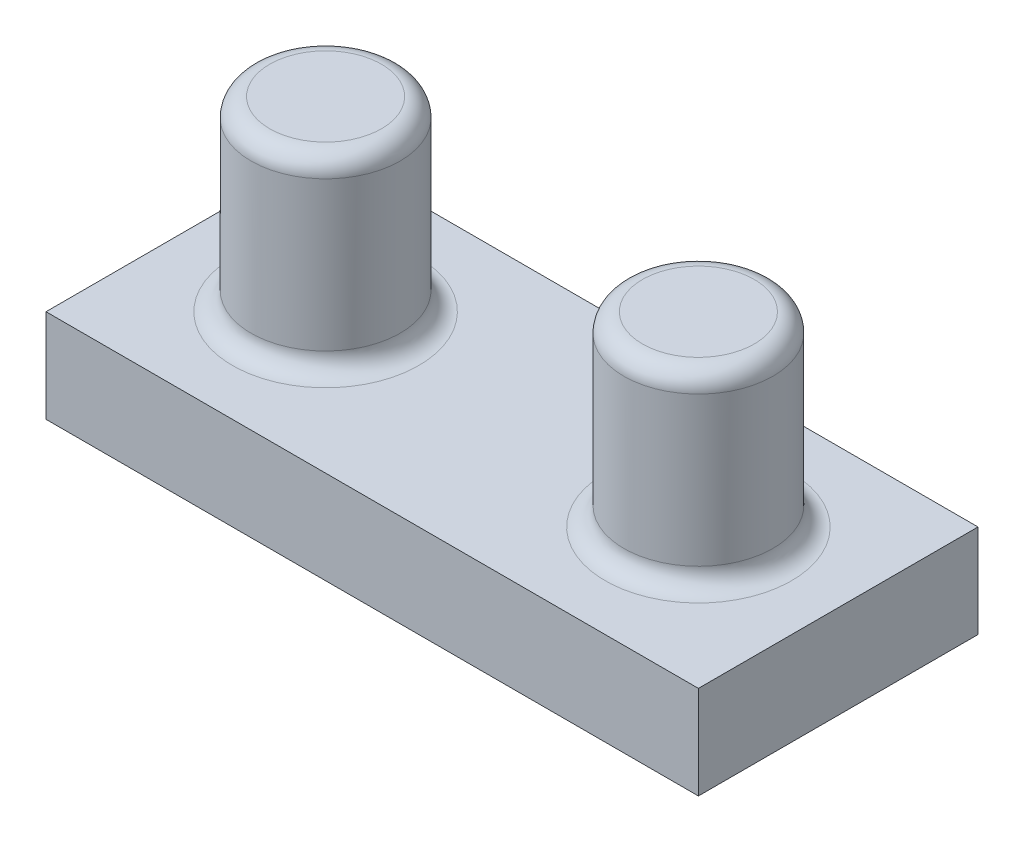
from build123d import *

# Parameters (mm, degrees)
SKETCH1_R             = 4
BOSS_EXTRUDE1_DEPTH   = 10
BOSS_EXTRUDE1_2_DEPTH = 10
SKETCH2_W             = 35
SKETCH2_H             = 15
BOSS_EXTRUDE2_DEPTH   = 5
FILLET1_R             = 1
CUT_EXTRUDE1_DEPTH    = 1


with BuildPart() as part:
    # Sketch1 → Boss-Extrude1 (new body)
    with BuildSketch(Plane(origin=(0, 0, 0), x_dir=(1, 0, 0), z_dir=(0, 1, 0))):
        with Locations(Location((9.086709746, 7.169703638, 0), (0, 0, 270))):
            Circle(SKETCH1_R)
    extrude(amount=BOSS_EXTRUDE1_DEPTH)



with BuildPart() as body_2:
    # Sketch1 → Boss-Extrude1 2 (new body)
    with BuildSketch(Plane(origin=(0, 0, 0), x_dir=(1, 0, 0), z_dir=(0, 1, 0))):
        with Locations(Location((-10.913290254, 7.169703638, 0), (0, 0, 270))):
            Circle(SKETCH1_R)
    extrude(amount=BOSS_EXTRUDE1_2_DEPTH)


with BuildPart() as part_1:
    add(part.part)

    add(body_2.part)  # Boss-Extrude2 merges body 2
    # Sketch2 → Boss-Extrude2 (add)
    with BuildSketch(Plane(origin=(0, 0, 0), x_dir=(-1, 0, 0), z_dir=(0, -1, 0))):
        with Locations((0.913290254, 7.169703638)):
            Rectangle(SKETCH2_W, SKETCH2_H)
    extrude(amount=BOSS_EXTRUDE2_DEPTH)

    # Fillet1
    fillet1_edges = [part_1.edges().sort_by_distance(p)[0] for p in [
        (-10.913290254, 0, -11.169703638),
        (-10.913290254, 10, -11.169703638),
        (9.086709746, 10, -11.169703638),
        (9.086709746, 0, -11.169703638),
    ]]
    fillet(fillet1_edges, radius=FILLET1_R)

    # Sketch3 → Cut-Extrude1 (cut)
    # profile 1 of 4: a face of its own
    with BuildSketch(Plane(origin=(0, 0, -14.669703638), x_dir=(-1, 0, 0), z_dir=(0, 0, -1))):
        with BuildLine():
            Line((4.304418078, -1.853490886), (4.618520642, -1.853490886))
            Line((4.618520642, -1.853490886), (4.618520642, -2.298002104))
            add(Edge.make_bspline(
                [(4.618520642, -2.298002104), (4.646804592, -2.259114502), (4.700999351, -2.184602129), (4.789865004, -2.086411845), (4.878641116, -2.00308369), (4.942574498, -1.959340819), (4.97328827, -1.938326623)],
                knots=[0, 0, 0, 0, 1.134379233, 2.173579362, 3.122582517, 4, 4, 4, 4], degree=3))
            add(Edge.make_bspline(
                [(4.97328827, -1.938326623), (5.015152932, -1.918321258), (5.098150832, -1.878660045), (5.229570057, -1.838426486), (5.364044726, -1.813701385), (5.45485294, -1.810320011), (5.50053186, -1.808619091)],
                knots=[0, 0, 0, 0, 1.014936303, 2.012140481, 3.000054389, 4, 4, 4, 4], degree=3))
            add(Edge.make_bspline(
                [(5.50053186, -1.808619091), (5.531424856, -1.809664382), (5.592560435, -1.811732956), (5.683144526, -1.825192992), (5.771003137, -1.848459165), (5.855617167, -1.880866489), (5.935337846, -1.920113175), (6.008427044, -1.966162883), (6.074051252, -2.017859959), (6.132177303, -2.077538892), (6.184446329, -2.14687549), (6.232525175, -2.227739739), (6.276950388, -2.3219474), (6.301571696, -2.390313941), (6.314534264, -2.426307393)],
                knots=[0, 0, 0, 0, 1.009824226, 1.998387844, 2.986035974, 3.974953746, 4.955485308, 5.885931332, 6.793869504, 7.679848016, 8.601185859, 9.625726857, 10.749998409, 12, 12, 12, 12], degree=3))
            add(Edge.make_bspline(
                [(6.314534264, -2.426307393), (6.328245515, -2.401582973), (6.355227332, -2.352928788), (6.400532969, -2.284070526), (6.448000766, -2.219663734), (6.498035259, -2.15965731), (6.550459846, -2.10434758), (6.605521246, -2.053551678), (6.662906027, -2.007051464), (6.742698267, -1.952728305), (6.846510875, -1.895027123), (6.977398989, -1.844998679), (7.113549161, -1.814082551), (7.205966859, -1.810452278), (7.252635225, -1.808619091)],
                knots=[0, 0, 0, 0, 0.86119277, 1.694706429, 2.50939023, 3.298075842, 4.073795165, 4.829715201, 5.57930267, 6.321991688, 7.768977793, 9.186738141, 10.579381044, 12, 12, 12, 12], degree=3))
            add(Edge.make_bspline(
                [(7.252635225, -1.808619091), (7.295516688, -1.810236312), (7.379439874, -1.81340137), (7.50161714, -1.838254844), (7.615558945, -1.880932491), (7.721036021, -1.939166127), (7.816195835, -2.012345311), (7.898912144, -2.099414148), (7.968682507, -2.199756771), (8.014261147, -2.29414876), (8.045176411, -2.377484093), (8.064237646, -2.448490384), (8.081077341, -2.526641937), (8.095058586, -2.612032199), (8.105277138, -2.704962807), (8.112847854, -2.805281683), (8.117971927, -2.913066794), (8.118333999, -2.987432295), (8.118520642, -3.025766527)],
                knots=[0, 0, 0, 0, 1.209669288, 2.367440248, 3.500751976, 4.631527125, 5.755587489, 6.87532382, 8.007944318, 9.190864318, 9.82315674, 10.514484317, 11.263564316, 12.079023757, 12.955305781, 13.901327259, 14.918167583, 16, 16, 16, 16], degree=3))
            Line((8.118520642, -3.025766527), (8.118520642, -4.411183194))
            Line((8.118520642, -4.411183194), (7.804418078, -4.411183194))
            Line((7.804418078, -4.411183194), (7.804418078, -3.024364284))
            add(Edge.make_bspline(
                [(7.804418078, -3.024364284), (7.804340195, -2.99164371), (7.804190516, -2.928759743), (7.801496884, -2.838507292), (7.79642157, -2.756238934), (7.790486931, -2.682066846), (7.782243122, -2.615818058), (7.77159719, -2.557625639), (7.76031951, -2.507031828), (7.741583519, -2.45094578), (7.711635627, -2.38907557), (7.666018147, -2.322351994), (7.608548041, -2.264271194), (7.542187885, -2.213852877), (7.46663944, -2.172859236), (7.383374717, -2.143583226), (7.292910665, -2.125460348), (7.230287877, -2.123654332), (7.197947725, -2.122721655)],
                knots=[0, 0, 0, 0, 1.253487763, 2.409012846, 3.458416907, 4.410876679, 5.259312806, 6.014470957, 6.676830364, 7.243083969, 8.276244668, 9.299465089, 10.325150304, 11.392391894, 12.482080715, 13.603491619, 14.762376348, 16, 16, 16, 16], degree=3))
            add(Edge.make_bspline(
                [(7.197947725, -2.122721655), (7.158277771, -2.124137813), (7.07987486, -2.126936678), (6.965429373, -2.155510551), (6.855458357, -2.198590802), (6.753243224, -2.261023259), (6.659215433, -2.335831623), (6.578315856, -2.424781219), (6.51148367, -2.525411146), (6.466229694, -2.618557848), (6.437640393, -2.702227292), (6.418763477, -2.775324664), (6.404080085, -2.858406232), (6.390309556, -2.950913722), (6.381321828, -3.053483903), (6.373153456, -3.165642304), (6.369332593, -3.287726263), (6.368798134, -3.372352952), (6.368520642, -3.416291367)],
                knots=[0, 0, 0, 0, 1.090531906, 2.155305635, 3.229839962, 4.33261226, 5.44038871, 6.529323825, 7.629011124, 8.757537029, 9.370236727, 10.061839251, 10.834451254, 11.692844982, 12.636905849, 13.66920014, 14.789842145, 16, 16, 16, 16], degree=3))
            Line((6.368520642, -3.416291367), (6.368520642, -4.411183194))
            Line((6.368520642, -4.411183194), (6.054418078, -4.411183194))
            Line((6.054418078, -4.411183194), (6.054418078, -3.110602264))
            add(Edge.make_bspline(
                [(6.054418078, -3.110602264), (6.054338647, -3.073908946), (6.05418583, -3.003314688), (6.051509512, -2.902081013), (6.046422891, -2.809999933), (6.040542342, -2.727178469), (6.032082164, -2.65376714), (6.022472402, -2.589372382), (6.011123791, -2.534155631), (5.992333906, -2.473592247), (5.963619438, -2.406871324), (5.917431176, -2.335730302), (5.859823596, -2.273462205), (5.79225272, -2.220303456), (5.716247038, -2.176361975), (5.632263637, -2.144702223), (5.541058724, -2.126277934), (5.478181018, -2.123929437), (5.44584436, -2.122721655)],
                knots=[0, 0, 0, 0, 1.320475261, 2.540461679, 3.643808994, 4.639130445, 5.527981419, 6.302341397, 6.981980563, 7.553956391, 8.582137848, 9.585246428, 10.591171744, 11.620968678, 12.668337649, 13.738356861, 14.836885341, 16, 16, 16, 16], degree=3))
            add(Edge.make_bspline(
                [(5.44584436, -2.122721655), (5.407828148, -2.124252115), (5.332063189, -2.127302268), (5.220761219, -2.154756542), (5.113275536, -2.197760617), (5.011320837, -2.257420436), (4.917646689, -2.331319514), (4.835638421, -2.41823441), (4.766695896, -2.517083444), (4.720964081, -2.60924796), (4.691465607, -2.690821235), (4.671870272, -2.760172183), (4.655030646, -2.837172431), (4.642516625, -2.922059542), (4.630436209, -3.014280636), (4.6246059, -3.114295126), (4.618934338, -3.222017214), (4.618661923, -3.296389759), (4.618520642, -3.334961239)],
                knots=[0, 0, 0, 0, 1.098833095, 2.189935336, 3.297829714, 4.440610912, 5.596351641, 6.740013378, 7.886572111, 9.072425424, 9.705826452, 10.395263256, 11.156850408, 11.985370555, 12.878090359, 13.847760091, 14.883794034, 16, 16, 16, 16], degree=3))
            Line((4.618520642, -3.334961239), (4.618520642, -4.411183194))
            Line((4.618520642, -4.411183194), (4.304418078, -4.411183194))
            Line((4.304418078, -4.411183194), (4.304418078, -1.853490886))
        make_face()
    # profile 2 of 4: a face of its own
    with BuildSketch(Plane(origin=(0, 0, -14.669703638), x_dir=(-1, 0, 0), z_dir=(0, 0, -1))):
        with BuildLine():
            Line((-0.227633204, -1.853490886), (0.08646936, -1.853490886))
            Line((0.08646936, -1.853490886), (0.08646936, -2.298002104))
            add(Edge.make_bspline(
                [(0.08646936, -2.298002104), (0.11475331, -2.259114502), (0.168948069, -2.184602129), (0.257813722, -2.086411845), (0.346589834, -2.00308369), (0.410523216, -1.959340819), (0.441236988, -1.938326623)],
                knots=[0, 0, 0, 0, 1.134379233, 2.173579362, 3.122582517, 4, 4, 4, 4], degree=3))
            add(Edge.make_bspline(
                [(0.441236988, -1.938326623), (0.48310165, -1.918321258), (0.56609955, -1.878660045), (0.697518775, -1.838426486), (0.831993444, -1.813701385), (0.922801658, -1.810320011), (0.968480578, -1.808619091)],
                knots=[0, 0, 0, 0, 1.014936303, 2.012140481, 3.000054389, 4, 4, 4, 4], degree=3))
            add(Edge.make_bspline(
                [(0.968480578, -1.808619091), (0.999373574, -1.809664382), (1.060509153, -1.811732956), (1.151093243, -1.825192992), (1.238951855, -1.848459165), (1.323565885, -1.880866489), (1.403286564, -1.920113175), (1.476375762, -1.966162883), (1.54199997, -2.017859959), (1.600126021, -2.077538892), (1.652395047, -2.14687549), (1.700473893, -2.227739739), (1.744899106, -2.3219474), (1.769520414, -2.390313941), (1.782482982, -2.426307393)],
                knots=[0, 0, 0, 0, 1.009824226, 1.998387844, 2.986035974, 3.974953746, 4.955485308, 5.885931332, 6.793869504, 7.679848016, 8.601185859, 9.625726857, 10.749998409, 12, 12, 12, 12], degree=3))
            add(Edge.make_bspline(
                [(1.782482982, -2.426307393), (1.796194233, -2.401582973), (1.82317605, -2.352928788), (1.868481687, -2.284070526), (1.915949484, -2.219663734), (1.965983977, -2.15965731), (2.018408564, -2.10434758), (2.073469964, -2.053551678), (2.130854745, -2.007051464), (2.210646985, -1.952728305), (2.314459593, -1.895027123), (2.445347707, -1.844998679), (2.581497879, -1.814082551), (2.673915577, -1.810452278), (2.720583943, -1.808619091)],
                knots=[0, 0, 0, 0, 0.86119277, 1.694706429, 2.50939023, 3.298075842, 4.073795165, 4.829715201, 5.57930267, 6.321991688, 7.768977793, 9.186738141, 10.579381044, 12, 12, 12, 12], degree=3))
            add(Edge.make_bspline(
                [(2.720583943, -1.808619091), (2.763465406, -1.810236312), (2.847388592, -1.81340137), (2.969565858, -1.838254844), (3.083507663, -1.880932491), (3.188984739, -1.939166127), (3.284144553, -2.012345311), (3.366860862, -2.099414148), (3.436631225, -2.199756771), (3.482209865, -2.29414876), (3.513125129, -2.377484093), (3.532186364, -2.448490384), (3.549026059, -2.526641937), (3.563007304, -2.612032199), (3.573225856, -2.704962807), (3.580796572, -2.805281683), (3.585920645, -2.913066794), (3.586282717, -2.987432295), (3.58646936, -3.025766527)],
                knots=[0, 0, 0, 0, 1.209669288, 2.367440248, 3.500751976, 4.631527125, 5.755587489, 6.87532382, 8.007944318, 9.190864318, 9.82315674, 10.514484317, 11.263564316, 12.079023757, 12.955305781, 13.901327259, 14.918167583, 16, 16, 16, 16], degree=3))
            Line((3.58646936, -3.025766527), (3.58646936, -4.411183194))
            Line((3.58646936, -4.411183194), (3.272366796, -4.411183194))
            Line((3.272366796, -4.411183194), (3.272366796, -3.024364284))
            add(Edge.make_bspline(
                [(3.272366796, -3.024364284), (3.272288913, -2.99164371), (3.272139234, -2.928759743), (3.269445602, -2.838507292), (3.264370288, -2.756238934), (3.258435649, -2.682066846), (3.25019184, -2.615818058), (3.239545908, -2.557625639), (3.228268228, -2.507031828), (3.209532237, -2.45094578), (3.179584345, -2.38907557), (3.133966865, -2.322351994), (3.076496759, -2.264271194), (3.010136603, -2.213852877), (2.934588158, -2.172859236), (2.851323435, -2.143583226), (2.760859383, -2.125460348), (2.698236595, -2.123654332), (2.665896443, -2.122721655)],
                knots=[0, 0, 0, 0, 1.253487763, 2.409012846, 3.458416907, 4.410876679, 5.259312806, 6.014470957, 6.676830364, 7.243083969, 8.276244668, 9.299465089, 10.325150304, 11.392391894, 12.482080715, 13.603491619, 14.762376348, 16, 16, 16, 16], degree=3))
            add(Edge.make_bspline(
                [(2.665896443, -2.122721655), (2.626226489, -2.124137813), (2.547823578, -2.126936678), (2.433378091, -2.155510551), (2.323407075, -2.198590802), (2.221191942, -2.261023259), (2.127164151, -2.335831623), (2.046264573, -2.424781219), (1.979432388, -2.525411146), (1.934178412, -2.618557848), (1.905589111, -2.702227292), (1.886712195, -2.775324664), (1.872028803, -2.858406232), (1.858258274, -2.950913722), (1.849270546, -3.053483903), (1.841102174, -3.165642304), (1.837281311, -3.287726263), (1.836746852, -3.372352952), (1.83646936, -3.416291367)],
                knots=[0, 0, 0, 0, 1.090531906, 2.155305635, 3.229839962, 4.33261226, 5.44038871, 6.529323825, 7.629011124, 8.757537029, 9.370236727, 10.061839251, 10.834451254, 11.692844982, 12.636905849, 13.66920014, 14.789842145, 16, 16, 16, 16], degree=3))
            Line((1.83646936, -3.416291367), (1.83646936, -4.411183194))
            Line((1.83646936, -4.411183194), (1.522366796, -4.411183194))
            Line((1.522366796, -4.411183194), (1.522366796, -3.110602264))
            add(Edge.make_bspline(
                [(1.522366796, -3.110602264), (1.522287365, -3.073908946), (1.522134548, -3.003314688), (1.51945823, -2.902081013), (1.514371609, -2.809999933), (1.50849106, -2.727178469), (1.500030882, -2.65376714), (1.49042112, -2.589372382), (1.479072509, -2.534155631), (1.460282624, -2.473592247), (1.431568156, -2.406871324), (1.385379894, -2.335730302), (1.327772314, -2.273462205), (1.260201438, -2.220303456), (1.184195756, -2.176361975), (1.100212355, -2.144702223), (1.009007442, -2.126277934), (0.946129736, -2.123929437), (0.913793078, -2.122721655)],
                knots=[0, 0, 0, 0, 1.320475261, 2.540461679, 3.643808994, 4.639130445, 5.527981419, 6.302341397, 6.981980563, 7.553956391, 8.582137848, 9.585246428, 10.591171744, 11.620968678, 12.668337649, 13.738356861, 14.836885341, 16, 16, 16, 16], degree=3))
            add(Edge.make_bspline(
                [(0.913793078, -2.122721655), (0.875776866, -2.124252115), (0.800011907, -2.127302268), (0.688709937, -2.154756542), (0.581224254, -2.197760617), (0.479269555, -2.257420436), (0.385595407, -2.331319514), (0.303587139, -2.41823441), (0.234644614, -2.517083444), (0.188912799, -2.60924796), (0.159414325, -2.690821235), (0.13981899, -2.760172183), (0.122979364, -2.837172431), (0.110465342, -2.922059542), (0.098384927, -3.014280636), (0.092554618, -3.114295126), (0.086883056, -3.222017214), (0.086610641, -3.296389759), (0.08646936, -3.334961239)],
                knots=[0, 0, 0, 0, 1.098833095, 2.189935336, 3.297829714, 4.440610912, 5.596351641, 6.740013378, 7.886572111, 9.072425424, 9.705826452, 10.395263256, 11.156850408, 11.985370555, 12.878090359, 13.847760091, 14.883794034, 16, 16, 16, 16], degree=3))
            Line((0.08646936, -3.334961239), (0.08646936, -4.411183194))
            Line((0.08646936, -4.411183194), (-0.227633204, -4.411183194))
            Line((-0.227633204, -4.411183194), (-0.227633204, -1.853490886))
        make_face()
    # profile 3 of 4: a face of its own
    with BuildSketch(Plane(origin=(0, 0, -14.669703638), x_dir=(-1, 0, 0), z_dir=(0, 0, -1))):
        with BuildLine():
            add(Edge.make_bspline(
                [(-4.490453717, -2.662585438), (-4.490125699, -2.60648805), (-4.489488519, -2.497518066), (-4.482400098, -2.338733423), (-4.470624756, -2.189773134), (-4.454487383, -2.050630068), (-4.434849403, -1.921268304), (-4.408633916, -1.802033547), (-4.378821113, -1.69237394), (-4.344268668, -1.591931892), (-4.305280879, -1.499354189), (-4.262846618, -1.412928987), (-4.215281823, -1.332787055), (-4.165304911, -1.257649265), (-4.110892839, -1.18874557), (-4.053594048, -1.125102907), (-3.991172172, -1.068192157), (-3.925749164, -1.016345854), (-3.856732699, -0.970896383), (-3.786090033, -0.930863644), (-3.713334927, -0.896663777), (-3.638268745, -0.869773341), (-3.561566187, -0.847562494), (-3.48295912, -0.832373547), (-3.402317756, -0.822816638), (-3.347886321, -0.82190297), (-3.320281441, -0.821439604)],
                knots=[0, 0, 0, 0, 1.646270934, 3.197905019, 4.663502075, 6.030701355, 7.308322542, 8.50163776, 9.611534131, 10.641858119, 11.616356847, 12.558055219, 13.465016945, 14.349605745, 15.204443733, 16.039544428, 16.859896111, 17.680448484, 18.487036065, 19.28249412, 20.06191084, 20.843045899, 21.620316918, 22.403196591, 23.190181807, 24, 24, 24, 24], degree=3))
            add(Edge.make_bspline(
                [(-3.320281441, -0.821439604), (-3.292445963, -0.821927419), (-3.237089954, -0.82289753), (-3.155249579, -0.832221473), (-3.075299897, -0.847692596), (-2.997581758, -0.86961357), (-2.921456772, -0.896809247), (-2.847520364, -0.930896364), (-2.775313283, -0.970575232), (-2.705982995, -1.017199109), (-2.63876838, -1.069181385), (-2.575320417, -1.127944054), (-2.515633331, -1.192893773), (-2.458958026, -1.263335637), (-2.406902428, -1.340620722), (-2.357328996, -1.423404832), (-2.31295696, -1.513135696), (-2.270222285, -1.608316164), (-2.233335298, -1.711579823), (-2.200069053, -1.822344584), (-2.173190084, -1.941918771), (-2.150800812, -2.069675016), (-2.133455916, -2.206082499), (-2.120823274, -2.350848815), (-2.114150189, -2.504069205), (-2.112893488, -2.608827054), (-2.112248589, -2.662585438)],
                knots=[0, 0, 0, 0, 0.810914788, 1.612654377, 2.396697861, 3.181598691, 3.963628158, 4.749916497, 5.551656086, 6.361998678, 7.18212741, 8.025565596, 8.878627764, 9.750805457, 10.657531673, 11.591944965, 12.560506719, 13.57287815, 14.630710178, 15.753379473, 16.941251878, 18.199788006, 19.531962791, 20.947069417, 22.433333509, 24, 24, 24, 24], degree=3))
            add(Edge.make_bspline(
                [(-2.112248589, -2.662585438), (-2.112900173, -2.716109345), (-2.114169759, -2.820398497), (-2.120748466, -2.972929473), (-2.133707097, -3.116927516), (-2.149917086, -3.252737978), (-2.172368049, -3.379795597), (-2.199973215, -3.498540046), (-2.230623538, -3.609484117), (-2.268458332, -3.711718929), (-2.309869042, -3.806670652), (-2.354924238, -3.8953378), (-2.403194064, -3.978504093), (-2.455782809, -4.05550384), (-2.511836223, -4.126882497), (-2.572554011, -4.191380119), (-2.636224596, -4.250550791), (-2.703637012, -4.303202419), (-2.774048564, -4.349287224), (-2.84600764, -4.390501074), (-2.920791024, -4.423733769), (-2.996703977, -4.45226881), (-3.074832343, -4.474069262), (-3.155078733, -4.489143117), (-3.237034969, -4.499714966), (-3.292436534, -4.500521446), (-3.320281441, -4.500926784)],
                knots=[0, 0, 0, 0, 1.561518951, 3.042555995, 4.452378317, 5.7783523, 7.031515105, 8.214008947, 9.334062868, 10.386615937, 11.391082383, 12.354592575, 13.286541444, 14.194233754, 15.072674879, 15.931287219, 16.775624067, 17.606195743, 18.42308326, 19.229000347, 20.022332153, 20.807536673, 21.593273796, 22.3848459, 23.188221202, 24, 24, 24, 24], degree=3))
            add(Edge.make_bspline(
                [(-3.320281441, -4.500926784), (-3.347885555, -4.500460428), (-3.40231548, -4.499540866), (-3.482967906, -4.490027135), (-3.561250349, -4.474731632), (-3.637549103, -4.453315027), (-3.712255618, -4.427100191), (-3.784351905, -4.392946508), (-3.854639589, -4.353612439), (-3.922931145, -4.308817017), (-3.987943306, -4.257495334), (-4.050041911, -4.200731045), (-4.10766693, -4.137107634), (-4.161301026, -4.067629711), (-4.212275114, -3.992936469), (-4.259164487, -3.912008096), (-4.302535341, -3.825165485), (-4.342178832, -3.731847574), (-4.377327495, -3.630692647), (-4.408375204, -3.520543468), (-4.432889361, -3.400427832), (-4.453872316, -3.271310465), (-4.470796699, -3.132636534), (-4.482351025, -2.984330756), (-4.48949234, -2.826485547), (-4.49012741, -2.718215773), (-4.490453717, -2.662585438)],
                knots=[0, 0, 0, 0, 0.810891512, 1.598919785, 2.382837074, 3.152667961, 3.926044502, 4.706494248, 5.493654104, 6.291793342, 7.103789334, 7.925228297, 8.761435821, 9.622817696, 10.50288917, 11.416980706, 12.369136599, 13.353924996, 14.394355917, 15.514179734, 16.714354668, 17.994756427, 19.357759367, 20.818452758, 22.365282078, 24, 24, 24, 24], degree=3))
        make_face()
        with BuildLine():
            add(Edge.make_bspline(
                [(-4.176351153, -2.661183194), (-4.176231706, -2.707931893), (-4.175999883, -2.798661938), (-4.169943682, -2.930505198), (-4.16169345, -3.053475527), (-4.151052153, -3.167729064), (-4.135249204, -3.272879076), (-4.117542417, -3.369648759), (-4.095994327, -3.457525996), (-4.070499309, -3.537113807), (-4.041460212, -3.609762876), (-4.009754348, -3.677364091), (-3.975693626, -3.740716027), (-3.937574475, -3.799249636), (-3.896059412, -3.8531558), (-3.852086153, -3.903388632), (-3.804013568, -3.948185613), (-3.737509826, -4.001912468), (-3.649713351, -4.057431602), (-3.539092896, -4.105777692), (-3.425424445, -4.136160148), (-3.348273195, -4.140023904), (-3.309764615, -4.141952425)],
                knots=[0, 0, 0, 0, 1.459021318, 2.831673884, 4.118529203, 5.306027144, 6.411944654, 7.436330062, 8.375795394, 9.233974572, 10.042671642, 10.816086306, 11.563610507, 12.285937304, 12.993564865, 13.685989202, 14.367179055, 15.041617293, 16.353048772, 17.594441528, 18.799311195, 20, 20, 20, 20], degree=3))
            add(Edge.make_bspline(
                [(-3.309764615, -4.141952425), (-3.271006943, -4.140354644), (-3.19357162, -4.137162381), (-3.080437825, -4.106363644), (-2.970607554, -4.059894104), (-2.884535614, -4.004946599), (-2.819053071, -3.952618269), (-2.772136081, -3.908003621), (-2.729074032, -3.858047754), (-2.688231957, -3.804148458), (-2.650772882, -3.745275974), (-2.616709744, -3.681713398), (-2.585626396, -3.61328422), (-2.56791735, -3.565514481), (-2.558863172, -3.541091046)],
                knots=[0, 0, 0, 0, 1.353760809, 2.704726607, 4.075137775, 5.516104923, 6.260822281, 7.007110065, 7.778089737, 8.566572457, 9.372053459, 10.217411131, 11.088608312, 12, 12, 12, 12], degree=3))
            add(Edge.make_bspline(
                [(-2.558863172, -3.541091046), (-2.548311404, -3.509861307), (-2.526886791, -3.446451543), (-2.499275016, -3.348087891), (-2.477529617, -3.244885127), (-2.457966251, -3.13746001), (-2.444613195, -3.025020309), (-2.433865382, -2.907913925), (-2.427534695, -2.786052563), (-2.426749944, -2.703257572), (-2.426351153, -2.661183194)],
                knots=[0, 0, 0, 0, 0.884706709, 1.796334032, 2.740027952, 3.714592787, 4.726048262, 5.777819803, 6.87074269, 8, 8, 8, 8], degree=3))
            add(Edge.make_bspline(
                [(-2.426351153, -2.661183194), (-2.426901342, -2.619115621), (-2.42797763, -2.536822457), (-2.432091618, -2.416304276), (-2.442715192, -2.301836515), (-2.454514311, -2.192926042), (-2.471911532, -2.09017574), (-2.490669339, -1.992725434), (-2.515870551, -1.90178241), (-2.542790326, -1.815922828), (-2.573600722, -1.736122173), (-2.607516456, -1.662008387), (-2.643738215, -1.593223662), (-2.683080455, -1.529956721), (-2.725076138, -1.471924178), (-2.770833688, -1.420289583), (-2.81853806, -1.373452615), (-2.885355246, -1.319990046), (-2.972829536, -1.265478351), (-3.081675183, -1.215312591), (-3.194945828, -1.186504298), (-3.271519282, -1.182442611), (-3.309764615, -1.180413963)],
                knots=[0, 0, 0, 0, 1.31362396, 2.569729283, 3.763502607, 4.902122613, 5.988968491, 7.01645872, 7.998833611, 8.933434873, 9.825090667, 10.667526885, 11.477055099, 12.250526234, 12.991942729, 13.710640831, 14.402115721, 15.076753259, 16.378508321, 17.609869233, 18.806226677, 20, 20, 20, 20], degree=3))
            add(Edge.make_bspline(
                [(-3.309764615, -1.180413963), (-3.348475207, -1.18244541), (-3.425966912, -1.186512004), (-3.540414867, -1.215205257), (-3.650119219, -1.265218223), (-3.737362193, -1.320170596), (-3.80422598, -1.372508907), (-3.851308673, -1.417895361), (-3.895454845, -1.467541616), (-3.936122546, -1.521943531), (-3.974211829, -1.580408898), (-4.009192841, -1.643397663), (-4.040710171, -1.711229027), (-4.069794707, -1.783845462), (-4.095367495, -1.863426407), (-4.116461458, -1.9511954), (-4.135948512, -2.047657292), (-4.14974378, -2.1533768), (-4.162007536, -2.267658953), (-4.169888884, -2.390936272), (-4.176020142, -2.523000652), (-4.176238606, -2.614199811), (-4.176351153, -2.661183194)],
                knots=[0, 0, 0, 0, 1.207732386, 2.417664972, 3.655092373, 4.956220595, 5.625982001, 6.301752483, 6.994047911, 7.697131622, 8.419323945, 9.170223765, 9.943494443, 10.752040957, 11.610060368, 12.549350801, 13.567764191, 14.679664412, 15.874934091, 17.154273443, 18.533957287, 20, 20, 20, 20], degree=3))
        make_face(mode=Mode.SUBTRACT)
    # profile 4 of 4: a face of its own
    with BuildSketch(Plane(origin=(0, 0, -14.669703638), x_dir=(-1, 0, 0), z_dir=(0, 0, -1))):
        with BuildLine():
            Line((-6.734043461, -1.988106271), (-7.048146025, -1.988106271))
            add(Edge.make_bspline(
                [(-7.048146025, -1.988106271), (-7.046098872, -1.946435383), (-7.042078318, -1.864594868), (-7.023250029, -1.745270962), (-6.996309151, -1.631216163), (-6.958217697, -1.523346249), (-6.91091142, -1.420707442), (-6.854181392, -1.323707426), (-6.786987542, -1.232716238), (-6.710780808, -1.148577394), (-6.628012169, -1.071389824), (-6.538706229, -1.004734581), (-6.444861202, -0.94841691), (-6.346761803, -0.901335668), (-6.243301239, -0.865995822), (-6.135418381, -0.839774182), (-6.022639245, -0.823997836), (-5.945799223, -0.822302051), (-5.906719743, -0.821439604)],
                knots=[0, 0, 0, 0, 1.10065271, 2.161652631, 3.183658789, 4.190468796, 5.17591951, 6.163126047, 7.15150782, 8.156236427, 9.156009102, 10.134482811, 11.092018607, 12.041330605, 13.001268258, 13.972401359, 14.968799086, 16, 16, 16, 16], degree=3))
            add(Edge.make_bspline(
                [(-5.906719743, -0.821439604), (-5.868341669, -0.822338061), (-5.792930124, -0.824103495), (-5.68286811, -0.839264525), (-5.578090815, -0.863010116), (-5.478803049, -0.896325533), (-5.385796984, -0.94110996), (-5.298373939, -0.994907499), (-5.215493129, -1.05712733), (-5.140886345, -1.130381144), (-5.072378266, -1.208583528), (-5.013276011, -1.292071432), (-4.962662847, -1.378300717), (-4.920475167, -1.467928919), (-4.889419028, -1.561799947), (-4.86584082, -1.65854715), (-4.852513407, -1.759171961), (-4.850467983, -1.827278517), (-4.849428076, -1.861904348)],
                knots=[0, 0, 0, 0, 1.111607364, 2.184268762, 3.212621178, 4.221274766, 5.211760367, 6.196651075, 7.1921475, 8.207485113, 9.220403448, 10.201281604, 11.166441695, 12.114753415, 13.065576456, 14.026450734, 14.996634279, 16, 16, 16, 16], degree=3))
            add(Edge.make_bspline(
                [(-4.849428076, -1.861904348), (-4.851121339, -1.910652182), (-4.85447815, -2.007292396), (-4.883192527, -2.149307259), (-4.928039038, -2.286900678), (-4.982036395, -2.39763798), (-5.036508839, -2.486871474), (-5.085596346, -2.560340179), (-5.143061157, -2.639445647), (-5.209739655, -2.723922984), (-5.284252528, -2.814433889), (-5.367274691, -2.910923685), (-5.459398173, -3.012395455), (-5.524056674, -3.081701056), (-5.557561089, -3.117613482)],
                knots=[0, 0, 0, 0, 1.184426356, 2.348067706, 3.509069118, 4.696110526, 5.333549288, 6.050745305, 6.844228056, 7.710549037, 8.667450064, 9.695053472, 10.805634456, 12, 12, 12, 12], degree=3))
            Line((-5.557561089, -3.117613482), (-6.433262211, -4.052208835))
            Line((-6.433262211, -4.052208835), (-4.804556281, -4.052208835))
            Line((-4.804556281, -4.052208835), (-4.804556281, -4.411183194))
            Line((-4.804556281, -4.411183194), (-7.182761409, -4.411183194))
            Line((-7.182761409, -4.411183194), (-5.825389615, -2.962665566))
            add(Edge.make_bspline(
                [(-5.825389615, -2.962665566), (-5.792341728, -2.928167259), (-5.728863501, -2.861903073), (-5.639080924, -2.765160112), (-5.558441935, -2.675410572), (-5.486424543, -2.592824023), (-5.424591037, -2.516192455), (-5.369718805, -2.447997752), (-5.325753214, -2.385243302), (-5.278037819, -2.312502688), (-5.231823837, -2.22369037), (-5.192111481, -2.115156681), (-5.167896633, -2.003429429), (-5.164991797, -1.927927391), (-5.16353064, -1.88994922)],
                knots=[0, 0, 0, 0, 1.329631726, 2.553950428, 3.673215718, 4.687767853, 5.603093632, 6.413772471, 7.123043292, 7.734684054, 8.834405432, 9.900288307, 10.943827018, 12, 12, 12, 12], degree=3))
            add(Edge.make_bspline(
                [(-5.16353064, -1.88994922), (-5.164166382, -1.866067821), (-5.165419308, -1.819002171), (-5.176477006, -1.749996412), (-5.193187512, -1.683431598), (-5.21713277, -1.619102979), (-5.24873951, -1.557657327), (-5.28721289, -1.499019847), (-5.331602954, -1.442330881), (-5.382954223, -1.389177583), (-5.439365743, -1.340496378), (-5.498959992, -1.297372292), (-5.562010097, -1.261333182), (-5.628250219, -1.231789684), (-5.697495688, -1.208614303), (-5.769880433, -1.192555724), (-5.84520445, -1.18247324), (-5.896637945, -1.181109068), (-5.922845544, -1.180413963)],
                knots=[0, 0, 0, 0, 0.991446411, 1.95395049, 2.89581595, 3.838931463, 4.798493298, 5.75982156, 6.748411868, 7.785213223, 8.824556874, 9.840280684, 10.836137867, 11.835679398, 12.848801643, 13.863922112, 14.911575587, 16, 16, 16, 16], degree=3))
            add(Edge.make_bspline(
                [(-5.922845544, -1.180413963), (-5.950216377, -1.181128995), (-6.003968173, -1.182533201), (-6.082887206, -1.192355865), (-6.158172983, -1.209301705), (-6.230014886, -1.232478379), (-6.298534472, -1.261936928), (-6.363398516, -1.298628673), (-6.424461406, -1.342412166), (-6.481837929, -1.392052722), (-6.534701908, -1.447320324), (-6.581148784, -1.508930287), (-6.621732798, -1.575757702), (-6.657142031, -1.647622253), (-6.685897722, -1.725176033), (-6.707870872, -1.808143738), (-6.725257719, -1.896165119), (-6.731066239, -1.956950204), (-6.734043461, -1.988106271)],
                knots=[0, 0, 0, 0, 1.031018746, 2.02475058, 2.990194455, 3.934040569, 4.864654155, 5.795059489, 6.735614925, 7.690564532, 8.649604399, 9.611025574, 10.590972636, 11.591080095, 12.624614302, 13.701020113, 14.821632451, 16, 16, 16, 16], degree=3))
        make_face()
    extrude(amount=-CUT_EXTRUDE1_DEPTH, mode=Mode.SUBTRACT)


solid = part_1.part
